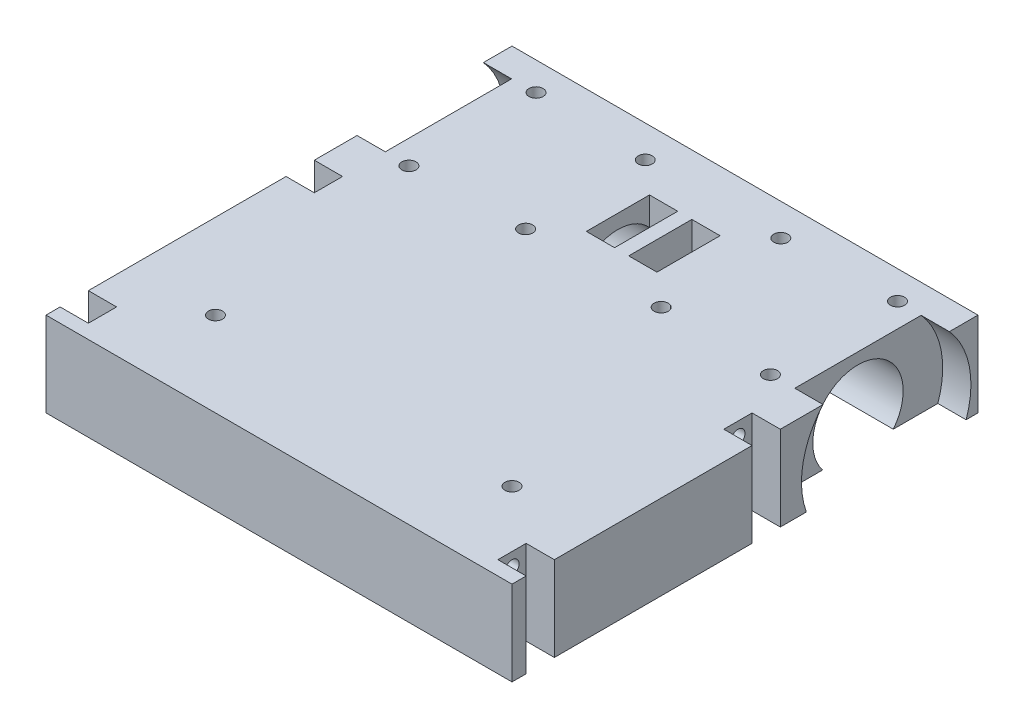
from build123d import *

# Parameters (mm, degrees)
ESQUISSE2_W         = 165
ESQUISSE2_H         = 165
BASE_DEPTH          = 30
ESQUISSE3_R         = 15
BLOC_MOTEUR_1_DEPTH = 80
ESQUISSE4_W         = 10
ESQUISSE4_H         = 22.360679774
ACCES_MOTEUR_DEPTH  = 37
ESQUISSE6_R         = 16.01
BLOC_MOTEUR_2_DEPTH = 37
ESQUISSE7_R         = 2.5
VIS_MOTEUR_DEPTH    = 121.467838032
ESQUISSE8_R         = 2.5
VIS_PATIN_DEPTH     = 121.467838032
ESQUISSE12_R        = 30
ESPACE_ROUE_DEPTH   = 10
ESQUISSE23_W        = 10
ESQUISSE23_H        = 30
VIDE_TIGE_DEPTH     = 10
VIDE_VIS_REACH      = 180.133
ESQUISSE25_R        = 2.5


with BuildPart() as part:
    # Esquisse2 → BASE (new body)
    with BuildSketch(Plane(origin=(0, 0, 0), x_dir=(1, 0, 0), z_dir=(0, 1, 0))):
        Rectangle(ESQUISSE2_W, ESQUISSE2_H)
    extrude(amount=BASE_DEPTH)

    # Esquisse3 → BLOC MOTEUR 1. (cut)
    with BuildSketch(Plane(origin=(82.5, 0, 0), x_dir=(0, 0, -1), z_dir=(1, 0, 0))):
        with Locations((50, 10)):
            Circle(ESQUISSE3_R)
    bloc_moteur_1 = extrude(amount=-BLOC_MOTEUR_1_DEPTH, mode=Mode.SUBTRACT)

    # Esquisse4 → ACCES MOTEUR (cut)
    with BuildSketch(Plane.XZ):
        with Locations((7.5, -50)):
            Rectangle(ESQUISSE4_W, ESQUISSE4_H)
    acces_moteur = extrude(amount=-ACCES_MOTEUR_DEPTH, mode=Mode.SUBTRACT)

    # Esquisse6 → BLOC MOTEUR 2 (cut)
    with BuildSketch(Plane(origin=(82.5, 0, 0), x_dir=(0, 0, -1), z_dir=(1, 0, 0))):
        with Locations((50, 10)):
            Circle(ESQUISSE6_R)
    bloc_moteur_2 = extrude(amount=-BLOC_MOTEUR_2_DEPTH, mode=Mode.SUBTRACT)

    # SYM BLOC MOTEUR: BLOC MOTEUR 1., ACCES MOTEUR, BLOC MOTEUR 2 across plane
    add(bloc_moteur_1.mirror(Plane(origin=(0, 0, 0), x_dir=(0, 0, 1), z_dir=(1, 0, 0))), mode=Mode.SUBTRACT)
    add(acces_moteur.mirror(Plane(origin=(0, 0, 0), x_dir=(0, 0, 1), z_dir=(1, 0, 0))), mode=Mode.SUBTRACT)
    add(bloc_moteur_2.mirror(Plane(origin=(0, 0, 0), x_dir=(0, 0, 1), z_dir=(1, 0, 0))), mode=Mode.SUBTRACT)

    # Esquisse7 → VIS MOTEUR (cut, through all)
    with BuildSketch(Plane.XZ):
        with Locations(Location((-64, -27.497196314, 0), (0, 0, 270))):
            Circle(ESQUISSE7_R)
        with Locations(Location((-24, -28.819660113, 0), (0, 0, 270))):
            Circle(ESQUISSE7_R)
        with Locations(Location((-24, -71.180339887, 0), (0, 0, 270))):
            Circle(ESQUISSE7_R)
        with Locations(Location((-64, -72.502803686, 0), (0, 0, 270))):
            Circle(ESQUISSE7_R)
    vis_moteur = extrude(amount=-VIS_MOTEUR_DEPTH, mode=Mode.SUBTRACT)

    # SYM VIS: VIS MOTEUR across plane
    add(vis_moteur.mirror(Plane(origin=(0, 0, 0), x_dir=(0, 0, 1), z_dir=(1, 0, 0))), mode=Mode.SUBTRACT)

    # Esquisse8 → VIS PATIN (cut, through all)
    with BuildSketch(Plane.XZ):
        with Locations(Location((-52.5, 52.5, 0), (0, 0, 270))):
            Circle(ESQUISSE8_R)
        with Locations(Location((52.5, 52.5, 0), (0, 0, 270))):
            Circle(ESQUISSE8_R)
    extrude(amount=-VIS_PATIN_DEPTH, mode=Mode.SUBTRACT)

    # Esquisse12 → ESPACE ROUE (cut)
    with BuildSketch(Plane.ZY.offset(82.5)):
        with Locations((-50, 10)):
            Circle(ESQUISSE12_R)
    espace_roue = extrude(amount=-ESPACE_ROUE_DEPTH, mode=Mode.SUBTRACT)

    # SYM ESPACE ROUE: ESPACE ROUE across plane
    add(espace_roue.mirror(Plane(origin=(0, 0, 0), x_dir=(0, 0, 1), z_dir=(1, 0, 0))), mode=Mode.SUBTRACT)

    # Esquisse23 → VIDE TIGE (cut)
    with BuildSketch(Plane(origin=(82.5, 0, 0), x_dir=(0, 0, -1), z_dir=(1, 0, 0))):
        with Locations((-72.5, 15)):
            Rectangle(ESQUISSE23_W, ESQUISSE23_H)
        with Locations((7.5, 15)):
            Rectangle(ESQUISSE23_W, ESQUISSE23_H)
    vide_tige = extrude(amount=-VIDE_TIGE_DEPTH, mode=Mode.SUBTRACT)

    # SYM TIGE: VIDE TIGE across plane
    add(vide_tige.mirror(Plane(origin=(0, 0, 0), x_dir=(0, 0, 1), z_dir=(1, 0, 0))), mode=Mode.SUBTRACT)

    # Esquisse25 → VIDE VIS (cut, up to next)
    with BuildSketch(Plane(origin=(72.5, 0, 0), x_dir=(0, 0, -1), z_dir=(1, 0, 0)), mode=Mode.PRIVATE) as vide_vis_sk1:
        with Locations((-72.5, 25)):
            Circle(ESQUISSE25_R)
    vide_vis_tool1 = extrude(vide_vis_sk1.sketch, amount=-VIDE_VIS_REACH, mode=Mode.PRIVATE) & part.part
    # Esquisse25 → VIDE VIS (cut, up to next)
    with BuildSketch(Plane(origin=(72.5, 0, 0), x_dir=(0, 0, -1), z_dir=(1, 0, 0)), mode=Mode.PRIVATE) as vide_vis_sk2:
        with Locations((-72.5, 15)):
            Circle(ESQUISSE25_R)
    vide_vis_tool2 = extrude(vide_vis_sk2.sketch, amount=-VIDE_VIS_REACH, mode=Mode.PRIVATE) & part.part
    # Esquisse25 → VIDE VIS (cut, up to next)
    with BuildSketch(Plane(origin=(72.5, 0, 0), x_dir=(0, 0, -1), z_dir=(1, 0, 0)), mode=Mode.PRIVATE) as vide_vis_sk3:
        with Locations((-72.5, 5)):
            Circle(ESQUISSE25_R)
    vide_vis_tool3 = extrude(vide_vis_sk3.sketch, amount=-VIDE_VIS_REACH, mode=Mode.PRIVATE) & part.part
    # Esquisse25 → VIDE VIS (cut, up to next)
    with BuildSketch(Plane(origin=(72.5, 0, 0), x_dir=(0, 0, -1), z_dir=(1, 0, 0)), mode=Mode.PRIVATE) as vide_vis_sk4:
        with Locations(Location((7.5, 5, 0), (0, 0, 180))):
            Circle(ESQUISSE25_R)
    vide_vis_tool4 = extrude(vide_vis_sk4.sketch, amount=-VIDE_VIS_REACH, mode=Mode.PRIVATE) & part.part
    # Esquisse25 → VIDE VIS (cut, up to next)
    with BuildSketch(Plane(origin=(72.5, 0, 0), x_dir=(0, 0, -1), z_dir=(1, 0, 0)), mode=Mode.PRIVATE) as vide_vis_sk5:
        with Locations(Location((7.5, 25, 0), (0, 0, 180))):
            Circle(ESQUISSE25_R)
    vide_vis_tool5 = extrude(vide_vis_sk5.sketch, amount=-VIDE_VIS_REACH, mode=Mode.PRIVATE) & part.part
    # Esquisse25 → VIDE VIS (cut, up to next)
    with BuildSketch(Plane(origin=(72.5, 0, 0), x_dir=(0, 0, -1), z_dir=(1, 0, 0)), mode=Mode.PRIVATE) as vide_vis_sk6:
        with Locations(Location((7.5, 15, 0), (0, 0, 180))):
            Circle(ESQUISSE25_R)
    vide_vis_tool6 = extrude(vide_vis_sk6.sketch, amount=-VIDE_VIS_REACH, mode=Mode.PRIVATE) & part.part
    add(vide_vis_tool1.solids().sort_by_distance((72.5, 25, 72.5))[0], mode=Mode.SUBTRACT)
    add(vide_vis_tool2.solids().sort_by_distance((72.5, 15, 72.5))[0], mode=Mode.SUBTRACT)
    add(vide_vis_tool3.solids().sort_by_distance((72.5, 5, 72.5))[0], mode=Mode.SUBTRACT)
    add(vide_vis_tool4.solids().sort_by_distance((72.5, 5, -7.5))[0], mode=Mode.SUBTRACT)
    add(vide_vis_tool5.solids().sort_by_distance((72.5, 25, -7.5))[0], mode=Mode.SUBTRACT)
    add(vide_vis_tool6.solids().sort_by_distance((72.5, 15, -7.5))[0], mode=Mode.SUBTRACT)


solid = part.part
